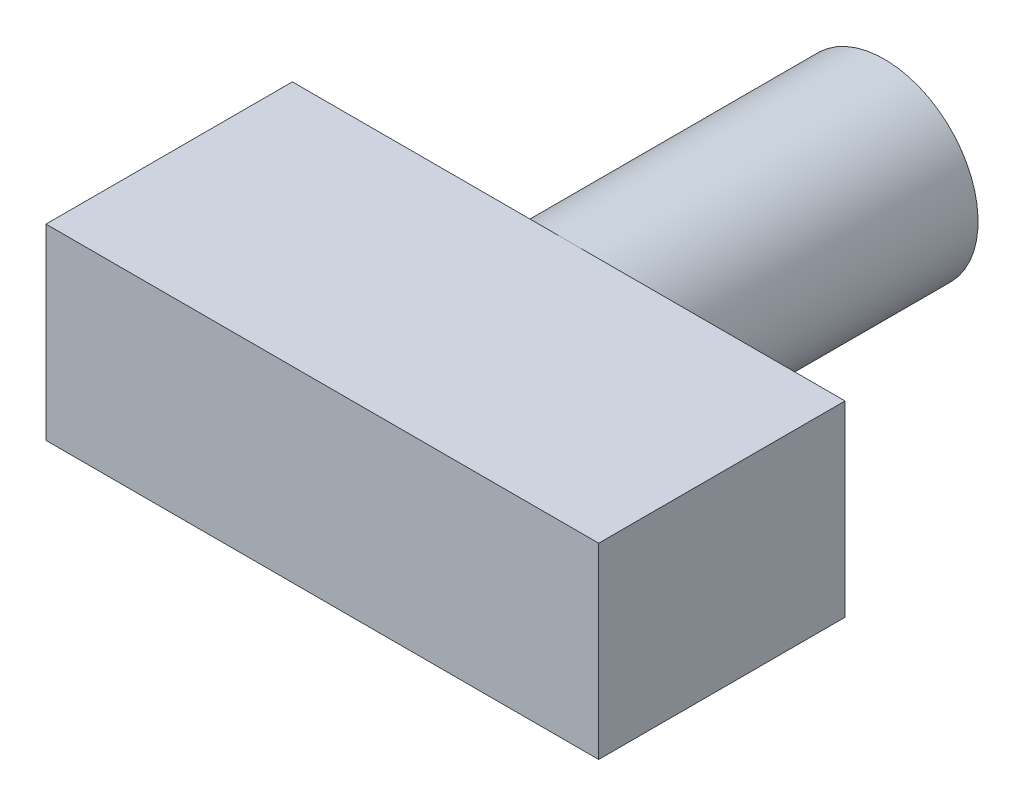
from build123d import *

# Parameters (mm, degrees)
ESBO_O4_W                = 11.8
ESBO_O4_H                = 4
RESSALTO_EXTRUS_O2_DEPTH = 5.26
ESBO_O5_R                = 2
RESSALTO_EXTRUS_O4_DEPTH = 6.74


with BuildPart() as part:
    # Esboço4 → Ressalto-extrusão2 (new body)
    with BuildSketch(Plane.XY.offset(6.74)):
        with Locations((70.144771166, -37.321923077)):
            Rectangle(ESBO_O4_W, ESBO_O4_H)
    extrude(amount=RESSALTO_EXTRUS_O2_DEPTH)

    # Esboço5 → Ressalto-extrusão4 (add)
    with BuildSketch(Plane(origin=(0, 0, 6.74), x_dir=(-1, 0, 0), z_dir=(0, 0, -1))):
        with Locations(Location((-70.144771166, -37.321923077, 0), (0, 0, 270))):
            Circle(ESBO_O5_R)
    extrude(amount=RESSALTO_EXTRUS_O4_DEPTH)


solid = part.part
